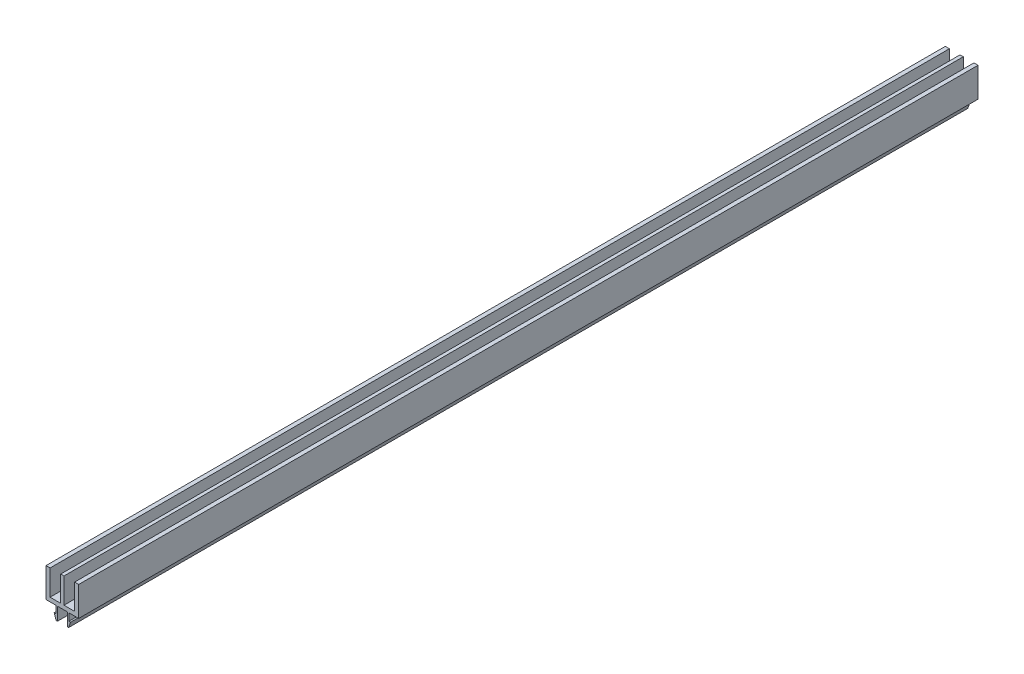
from build123d import *

# Parameters (mm, degrees)
BOSS_EXTRU_1_DEPTH = 550


with BuildPart() as part:
    # Esquisse1 → Boss.-Extru.1 (new body)
    with BuildSketch(Plane.XY.offset(50)):
        Polygon((-1, 2.5), (-7.5, 2.5), (-7.5, 17.999999998), (-10, 17.999999998), (-10, 0), (-4, 0), (-4, -4.5), (-5, -4.5), (-3.75, -8), (-3, -8), (-3, 0), (3, 0), (3, -8), (3.75, -8), (5, -4.5), (4, -4.5), (4, 0), (10, 0), (10, 17.999999998), (7.5, 17.999999998), (7.5, 2.5), (1, 2.5), (1, 17.999999998), (-1, 17.999999998), align=None)
    extrude(amount=-BOSS_EXTRU_1_DEPTH)


solid = part.part
